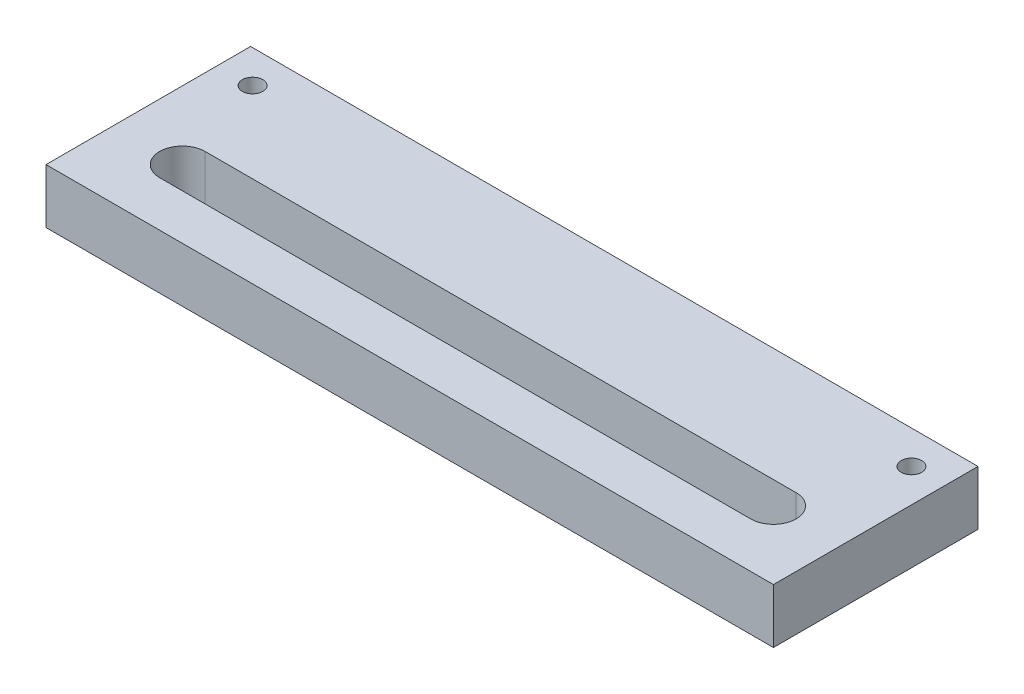
from build123d import *

# Parameters (mm, degrees)
SKETCH1_W                               = 160
SKETCH1_H                               = 45
BOSS_EXTRUDE1_DEPTH                     = 12
CBORE_FOR_M5_HEX_HEAD_BOLT5_D           = 4.5
CBORE_FOR_M5_HEX_HEAD_BOLT5_CBORE_D     = 10
CBORE_FOR_M5_HEX_HEAD_BOLT5_CBORE_DEPTH = 5
CBORE_FOR_M5_HEX_HEAD_BOLT7_D           = 4.5
CBORE_FOR_M5_HEX_HEAD_BOLT7_CBORE_D     = 10
CBORE_FOR_M5_HEX_HEAD_BOLT7_CBORE_DEPTH = 5
CUT_EXTRUDE4_DEPTH                      = 12


with BuildPart() as part:
    # Sketch1 → Boss-Extrude1 (new body)
    with BuildSketch(Plane(origin=(0, 0, 0), x_dir=(1, 0, 0), z_dir=(0, 1, 0))):
        with Locations((-80, -22.5)):
            Rectangle(SKETCH1_W, SKETCH1_H)
    extrude(amount=BOSS_EXTRUDE1_DEPTH)

    # CBORE for M5 Hex Head Bolt5 (through all)
    with Locations(Plane(origin=(0, 0, 0), x_dir=(-1, 0, 0), z_dir=(0, -1, 0))):
        with Locations((152.334853244, -7.222273521)):
            CounterBoreHole(CBORE_FOR_M5_HEX_HEAD_BOLT5_D / 2, CBORE_FOR_M5_HEX_HEAD_BOLT5_CBORE_D / 2, CBORE_FOR_M5_HEX_HEAD_BOLT5_CBORE_DEPTH)

    # CBORE for M5 Hex Head Bolt7 (through all)
    with Locations(Plane(origin=(0, 0, 0), x_dir=(-1, 0, 0), z_dir=(0, -1, 0))):
        with Locations((7.319954145, -7.319990423)):
            CounterBoreHole(CBORE_FOR_M5_HEX_HEAD_BOLT7_D / 2, CBORE_FOR_M5_HEX_HEAD_BOLT7_CBORE_D / 2, CBORE_FOR_M5_HEX_HEAD_BOLT7_CBORE_DEPTH)

    # Sketch17 → Cut-Extrude4 (cut)
    with BuildSketch(Plane(origin=(0, 0, 0), x_dir=(-1, 0, 0), z_dir=(0, -1, 0))):
        with BuildLine():
            ThreePointArc((145, -35), (150, -30), (145, -25))
            Line((145, -25), (15, -25))
            ThreePointArc((15, -25), (10, -30), (15, -35))
            Line((15, -35), (145, -35))
        make_face()
    extrude(amount=-CUT_EXTRUDE4_DEPTH, mode=Mode.SUBTRACT)


solid = part.part
